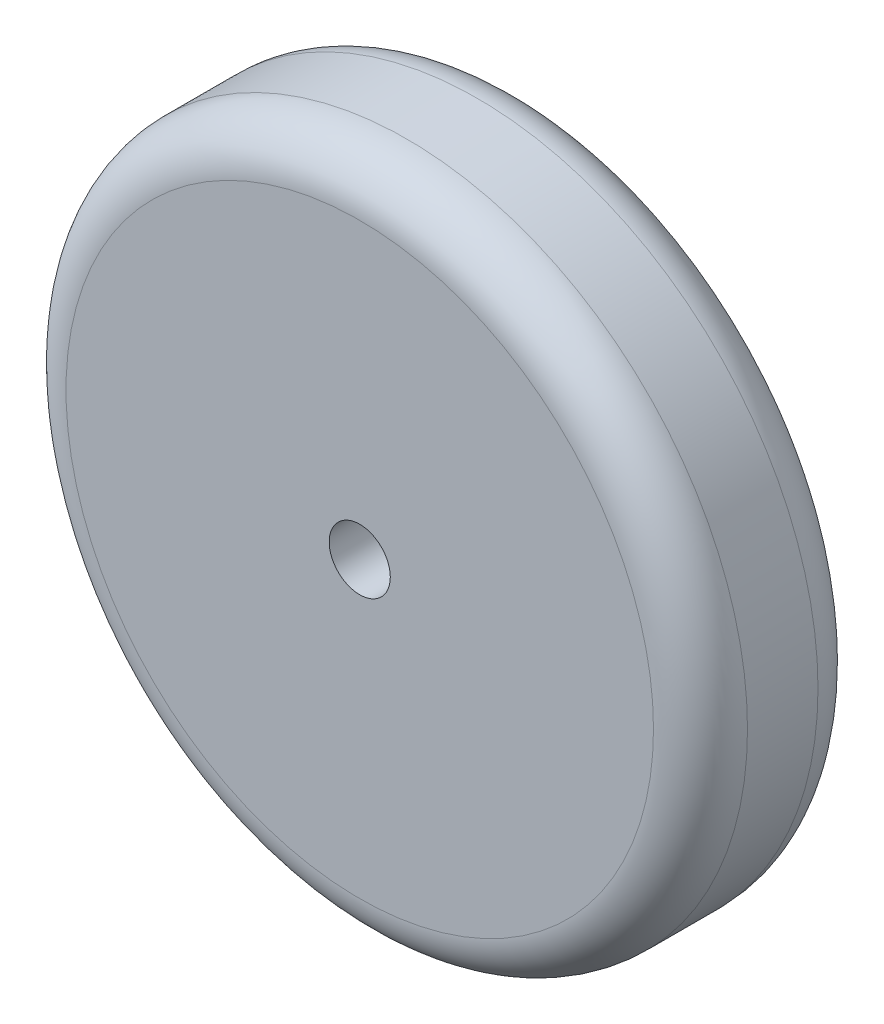
from build123d import *

# Parameters (mm, degrees)
SKETCH1_R           = 72.5
SKETCH1_R_2         = 6.5
BOSS_EXTRUDE1_DEPTH = 35
FILLET1_R           = 10
FILLET2_R           = 10


with BuildPart() as part:
    # Sketch1 → Boss-Extrude1 (new body)
    with BuildSketch(Plane.XY):
        Circle(SKETCH1_R)
        Circle(SKETCH1_R_2, mode=Mode.SUBTRACT)
    extrude(amount=BOSS_EXTRUDE1_DEPTH)

    # Fillet1
    fillet1_edges = [part.edges().sort_by_distance(p)[0] for p in [
        (-72.5, 0, 0),
    ]]
    fillet(fillet1_edges, radius=FILLET1_R)

    # Fillet2
    fillet2_edges = [part.edges().sort_by_distance(p)[0] for p in [
        (-72.5, 0, 35),
    ]]
    fillet(fillet2_edges, radius=FILLET2_R)


solid = part.part
